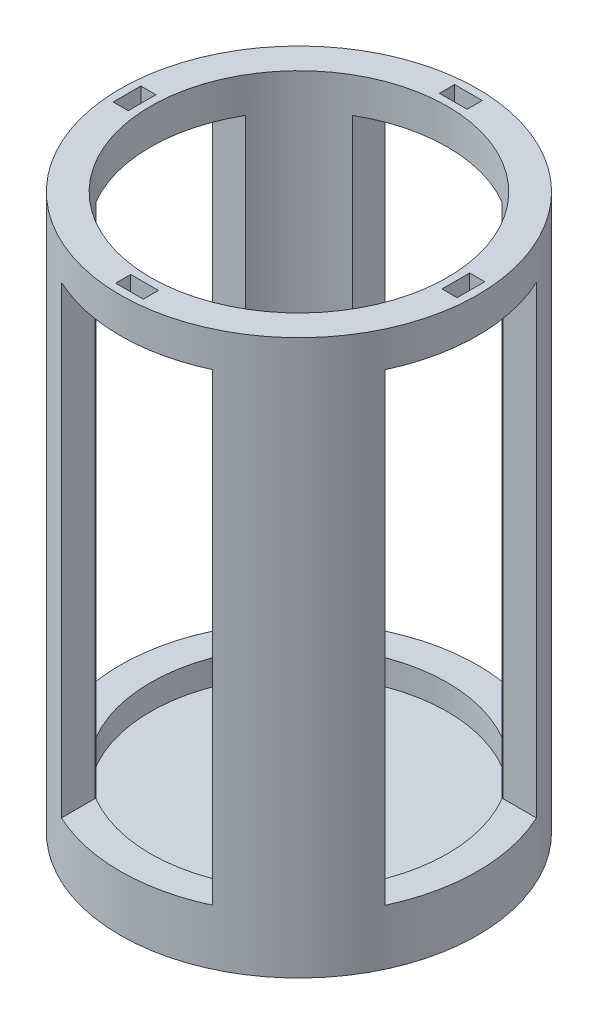
from build123d import *

# Parameters (mm, degrees)
SKETCH1_R           = 45
BOSS_EXTRUDE3_DEPTH = 139.7
SHELL2_T            = -7.62
SKETCH15_W          = 38.1
SKETCH15_H          = 116.84
CUT_EXTRUDE3_DEPTH  = 12.7
CIRPATTERN4_COUNT   = 4
SKETCH14_W          = 3.81
SKETCH14_H          = 6.985
CUT_EXTRUDE2_DEPTH  = 12.7
CIRPATTERN3_COUNT   = 4


with BuildPart() as part:
    # Sketch1 → Boss-Extrude3 (new body)
    with BuildSketch(Plane(origin=(0, 0, 0), x_dir=(1, 0, 0), z_dir=(0, 1, 0))):
        with Locations(Location((0, 0, 0), (0, 0, 270))):
            Circle(SKETCH1_R)
    extrude(amount=BOSS_EXTRUDE3_DEPTH)

    # Shell2
    shell2_openings = [part.faces().sort_by_distance(p)[0] for p in [
        (0, 139.7, 0),
    ]]
    offset(amount=SHELL2_T, openings=shell2_openings, kind=Kind.INTERSECTION)

    # Sketch15 → Cut-Extrude3 (cut)
    with BuildSketch(Plane(origin=(45, 0, 0), x_dir=(0, 0, -1), z_dir=(1, 0, 0))):
        with Locations((0, 72.39)):
            Rectangle(SKETCH15_W, SKETCH15_H)
    cut_extrude3 = extrude(amount=-CUT_EXTRUDE3_DEPTH, mode=Mode.SUBTRACT)

    # CirPattern4: Cut-Extrude3 ×4 about axis
    cirpattern4_axis = Axis((0, 0, 0), (0, 1, 0))
    for i in range(1, CIRPATTERN4_COUNT):
        add(cut_extrude3.rotate(cirpattern4_axis, i * 360 / CIRPATTERN4_COUNT), mode=Mode.SUBTRACT)

    # Sketch14 → Cut-Extrude2 (cut)
    with BuildSketch(Plane(origin=(0, 142.24, 0), x_dir=(1, 0, 0), z_dir=(0, 1, 0))):
        with Locations((-41.106583324, -0.3175)):
            Rectangle(SKETCH14_W, SKETCH14_H)
    cut_extrude2 = extrude(amount=-CUT_EXTRUDE2_DEPTH, mode=Mode.SUBTRACT)

    # CirPattern3: Cut-Extrude2 ×4 about axis
    cirpattern3_axis = Axis((0, 0, 0), (0, 1, 0))
    for i in range(1, CIRPATTERN3_COUNT):
        add(cut_extrude2.rotate(cirpattern3_axis, i * 360 / CIRPATTERN3_COUNT), mode=Mode.SUBTRACT)


solid = part.part
